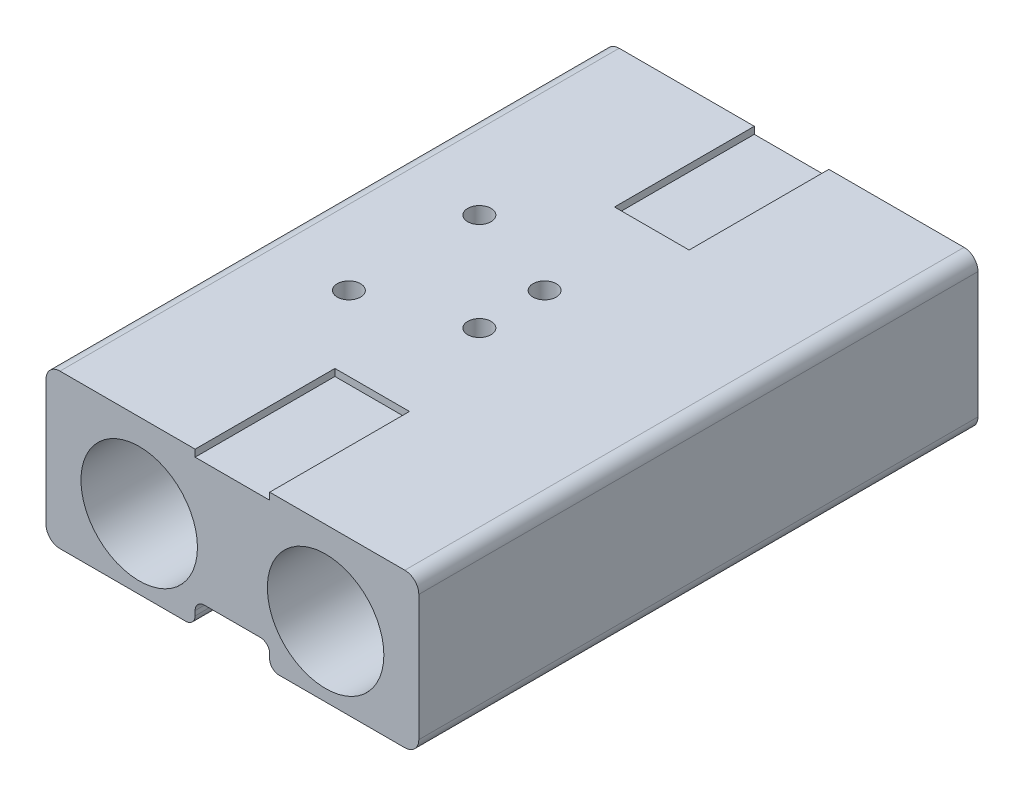
from build123d import *

# Parameters (mm, degrees)
SKETCH_1_R               = 3.5
EXTRUDE_1_DEPTH          = 60
FILLET_1_R               = 1.5
SKETCH_2_R               = 6.25
CUT_EXTRUDE_1_DEPTH      = 20
CUT_EXTRUDE_START        = -20
SKETCH_3_R               = 6.25
CUT_EXTRUDE_2_DEPTH      = 20
SKETCH_5_W               = 8
SKETCH_5_H               = 0.75
CUT_EXTRUDE_4_DEPTH      = 62
FILLET_2_R               = 1
SKETCH_7_W               = 8
SKETCH_7_H               = 30
EXTRUDE_2_DEPTH          = 2
SKETCH_6_R               = 1.25
CUT_EXTRUDE_5_DEPTH      = 62
SKETCH_8_R               = 1.25
CUT_EXTRUDE_6_DEPTH      = 5
CUT_EXTRUDE_9_DEPTH      = 5
CUT_EXTRUDE_9_DEPTH_BACK = 8


with BuildPart() as part:
    # 草图1 → 凸台-拉伸1 (new body)
    with BuildSketch(Plane.XY):
        Polygon((-20, -7.5), (-20, 9), (20, 9), (20, -7.5), (0, -7.5), align=None)
        with Locations((-10, 0)):
            Circle(SKETCH_1_R, mode=Mode.SUBTRACT)
        with Locations((10, 0)):
            Circle(SKETCH_1_R, mode=Mode.SUBTRACT)
    extrude(amount=EXTRUDE_1_DEPTH)

    # 圆角1
    fillet_1_edges = [part.edges().sort_by_distance(p)[0] for p in [
        (-20, -7.5, 30),
        (-20, 9, 30),
        (20, 9, 30),
        (20, -7.5, 30),
    ]]
    fillet(fillet_1_edges, radius=FILLET_1_R)

    # 草图2 → 切除-拉伸1 (cut)
    with BuildSketch(Plane.XY.offset(60)):
        with Locations((10, 0)):
            Circle(SKETCH_2_R)
        with Locations((-10, 0)):
            Circle(SKETCH_2_R)
    extrude(amount=-CUT_EXTRUDE_1_DEPTH, mode=Mode.SUBTRACT)

    # 草图3 → 切除-拉伸2 (cut)
    with BuildSketch(Plane(origin=(0, 0, 0), x_dir=(-1, 0, 0), z_dir=(0, 0, -1)).offset(CUT_EXTRUDE_START)):
        with Locations(Location((-10, 0, 0), (0, 0, 180))):
            Circle(SKETCH_3_R)
        with Locations(Location((10, 0, 0), (0, 0, 180))):
            Circle(SKETCH_3_R)
    extrude(amount=CUT_EXTRUDE_2_DEPTH, mode=Mode.SUBTRACT)

    # 草图5 → 切除-拉伸4 (cut)
    with BuildSketch(Plane(origin=(0, 0, 0), x_dir=(-1, 0, 0), z_dir=(0, 0, -1))):
        Polygon((0, -5), (4, -5), (4, -9), (-4, -9), (-4, -5), align=None)
        with Locations((0, 8.625)):
            Rectangle(SKETCH_5_W, SKETCH_5_H)
    extrude(amount=-CUT_EXTRUDE_4_DEPTH, mode=Mode.SUBTRACT)

    # 圆角2
    fillet_2_edges = [part.edges().sort_by_distance(p)[0] for p in [
        (4, -7.5, 30),
        (-4, -7.5, 30),
        (4, -5, 30),
        (-4, -5, 30),
    ]]
    fillet(fillet_2_edges, radius=FILLET_2_R)

    # 草图7 → 凸台-拉伸2 (add)
    with BuildSketch(Plane(origin=(0, 9, 0), x_dir=(1, 0, 0), z_dir=(0, 1, 0))):
        with Locations((0, -30)):
            Rectangle(SKETCH_7_W, SKETCH_7_H)
    extrude(amount=-EXTRUDE_2_DEPTH)

    # 草图6 → 切除-拉伸5 (cut)
    with BuildSketch(Plane(origin=(0, 9, 0), x_dir=(1, 0, 0), z_dir=(0, 1, 0))):
        with Locations(Location((0, -26.5, 0), (0, 0, 270))):
            Circle(SKETCH_6_R)
        with Locations(Location((0, -33.5, 0), (0, 0, 270))):
            Circle(SKETCH_6_R)
    extrude(amount=-CUT_EXTRUDE_5_DEPTH, mode=Mode.SUBTRACT)

    # 草图8 → 切除-拉伸6 (cut)
    with BuildSketch(Plane(origin=(0, 9, 0), x_dir=(1, 0, 0), z_dir=(0, 1, 0))):
        with Locations(Location((-10.5, -23, 0), (0, 0, 270))):
            Circle(SKETCH_8_R)
        with Locations(Location((-10.5, -37, 0), (0, 0, 270))):
            Circle(SKETCH_8_R)
    extrude(amount=-CUT_EXTRUDE_6_DEPTH, mode=Mode.SUBTRACT)

    # 草图9 → 切除-拉伸9 (cut, two sides: drawn at the far end of the back side and taken through both)
    with BuildSketch(Plane.XZ.offset(5).offset(-CUT_EXTRUDE_9_DEPTH_BACK)):
        with BuildLine():
            Line((2.474873734, 28.974873734), (2.474873734, 31.025126266))
            ThreePointArc((2.474873734, 31.025126266), (0, 37), (-2.474873734, 31.025126266))
            Line((-2.474873734, 31.025126266), (-2.474873734, 28.974873734))
            ThreePointArc((-2.474873734, 28.974873734), (0, 23), (2.474873734, 28.974873734))
        make_face()
    extrude(amount=CUT_EXTRUDE_9_DEPTH + CUT_EXTRUDE_9_DEPTH_BACK, mode=Mode.SUBTRACT)


solid = part.part
